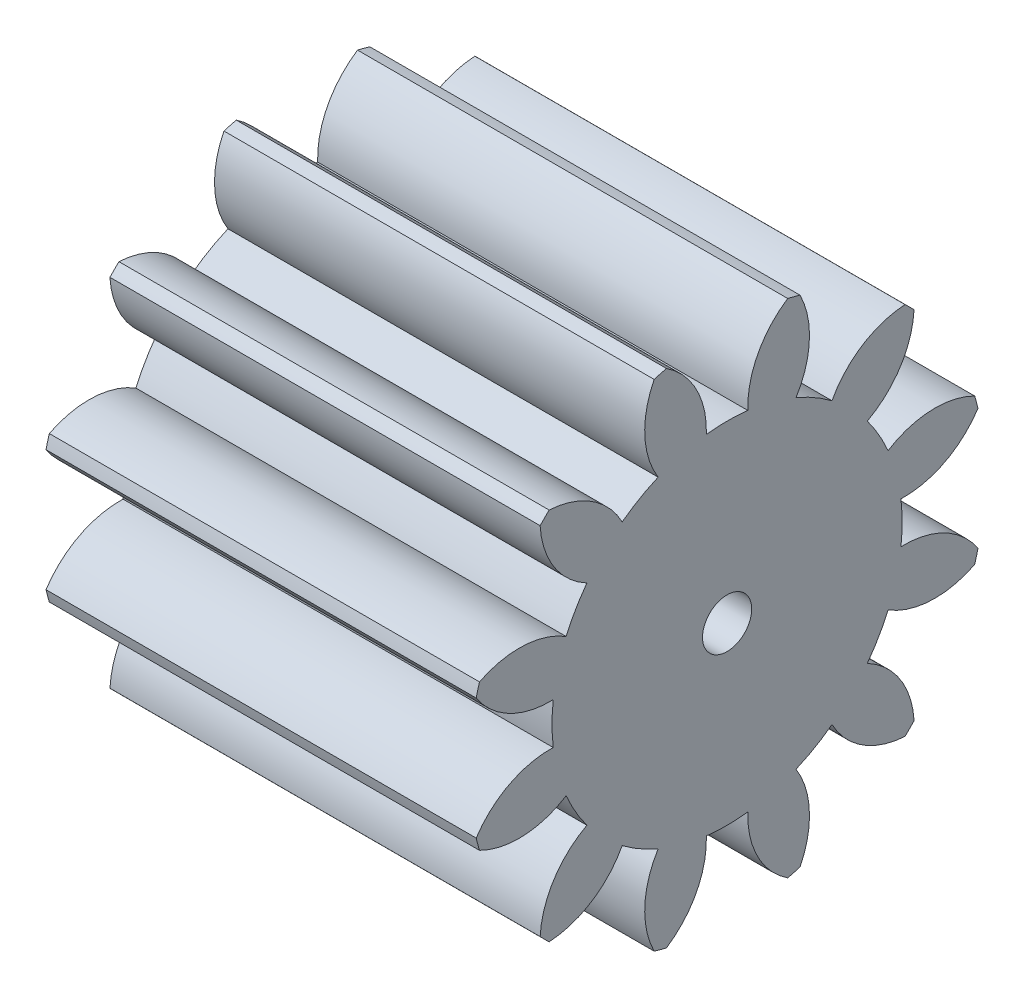
from build123d import *

# Parameters (mm, degrees)
BASPROSKE_W     = 7
BASPROSKE_H     = 4.2
TOOTHCUT_DEPTH  = 10.180413934
TEETHCUTS_COUNT = 12
TEETHCUTS_ANGLE = 330
BORSKE_R        = 0.4
BORE_DEPTH      = 50.0000508


with BuildPart() as part:
    # BasProSke → Base-Revolve (revolve)
    with BuildSketch(Plane(origin=(0, 0, 0), x_dir=(1, 0, 0), z_dir=(0, 1, 0)), mode=Mode.PRIVATE) as base_revolve_sk:
        with Locations((3.5, 2.1)):
            Rectangle(BASPROSKE_W, BASPROSKE_H)
    revolve(base_revolve_sk.sketch.rotate(Axis((-10, 0, 0), (1, 0, 0)), 180), axis=Axis((-10, 0, 0), (1, 0, 0)))

    # TooCutSke → ToothCut (cut, through all)
    with BuildSketch(Plane(origin=(0, 0, 0), x_dir=(0, 0, -1), z_dir=(1, 0, 0))):
        with BuildLine():
            ThreePointArc((0.337615381, 2.828925035), (0, 2.849), (-0.337615381, 2.828925035))
            ThreePointArc((-0.337615381, 2.828925035), (-0.506076789, 3.556215713), (-1.016063844, 4.101416758))
            ThreePointArc((-1.016063844, 4.101416758), (0, 4.2254), (1.016063844, 4.101416758))
            ThreePointArc((1.016063844, 4.101416758), (0.506076789, 3.556215713), (0.337615381, 2.828925035))
        make_face()
    toothcut = extrude(amount=TOOTHCUT_DEPTH, mode=Mode.SUBTRACT)

    # TeethCuts: ToothCut ×12 about axis
    teethcuts_axis = Axis((-10, 0, 0), (1, 0, 0))
    for i in range(1, TEETHCUTS_COUNT):
        add(toothcut.rotate(teethcuts_axis, i * TEETHCUTS_ANGLE / (TEETHCUTS_COUNT - 1)), mode=Mode.SUBTRACT)

    # BorSke → Bore (cut, symmetric)
    with BuildSketch(Plane(origin=(0, 0, 0), x_dir=(0, 0, -1), z_dir=(1, 0, 0))):
        with Locations(Location((0, 0, 0), (0, 0, 180))):
            Circle(BORSKE_R)
    extrude(amount=BORE_DEPTH, both=True, mode=Mode.SUBTRACT)


solid = part.part
